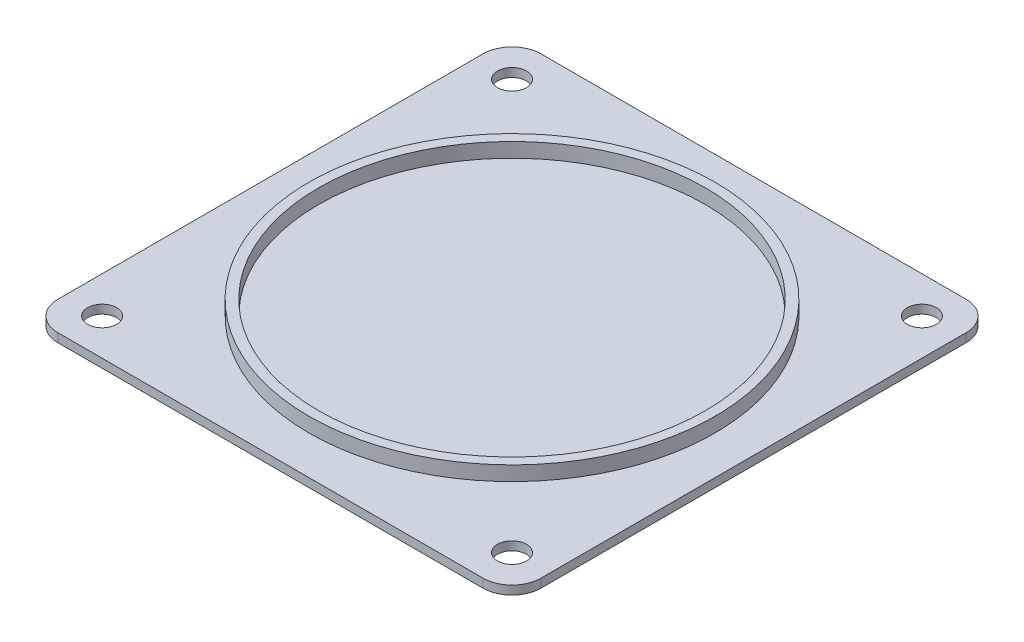
from build123d import *

# Parameters (mm, degrees)
SKETCH2_W           = 100
SKETCH2_H           = 100
SKETCH2_R           = 3
BOSS_EXTRUDE1_DEPTH = 1.8
FILLET1_R           = 6
SKETCH3_R           = 42
SKETCH3_R_2         = 40
BOSS_EXTRUDE2_DEPTH = 3


with BuildPart() as part:
    # Sketch2 → Boss-Extrude1 (new body)
    with BuildSketch(Plane(origin=(0, 0, 0), x_dir=(1, 0, 0), z_dir=(0, 1, 0))):
        Rectangle(SKETCH2_W, SKETCH2_H)
        with Locations(Location((-42.425, 42.425, 0), (0, 0, 270))):
            Circle(SKETCH2_R, mode=Mode.SUBTRACT)
        with Locations(Location((42.425, 42.425, 0), (0, 0, 270))):
            Circle(SKETCH2_R, mode=Mode.SUBTRACT)
        with Locations(Location((42.425, -42.425, 0), (0, 0, 270))):
            Circle(SKETCH2_R, mode=Mode.SUBTRACT)
        with Locations(Location((-42.425, -42.425, 0), (0, 0, 270))):
            Circle(SKETCH2_R, mode=Mode.SUBTRACT)
    extrude(amount=BOSS_EXTRUDE1_DEPTH)

    # Fillet1
    fillet1_edges = [part.edges().sort_by_distance(p)[0] for p in [
        (50, 0.9, 50),
        (-50, 0.9, 50),
        (-50, 0.9, -50),
        (50, 0.9, -50),
    ]]
    fillet(fillet1_edges, radius=FILLET1_R)

    # Sketch3 → Boss-Extrude2 (add)
    with BuildSketch(Plane(origin=(0, 1.8, 0), x_dir=(1, 0, 0), z_dir=(0, 1, 0))):
        with Locations(Location((0, 0, 0), (0, 0, 270))):
            Circle(SKETCH3_R)
        with Locations(Location((0, 0, 0), (0, 0, 270))):
            Circle(SKETCH3_R_2, mode=Mode.SUBTRACT)
    extrude(amount=BOSS_EXTRUDE2_DEPTH)


solid = part.part
